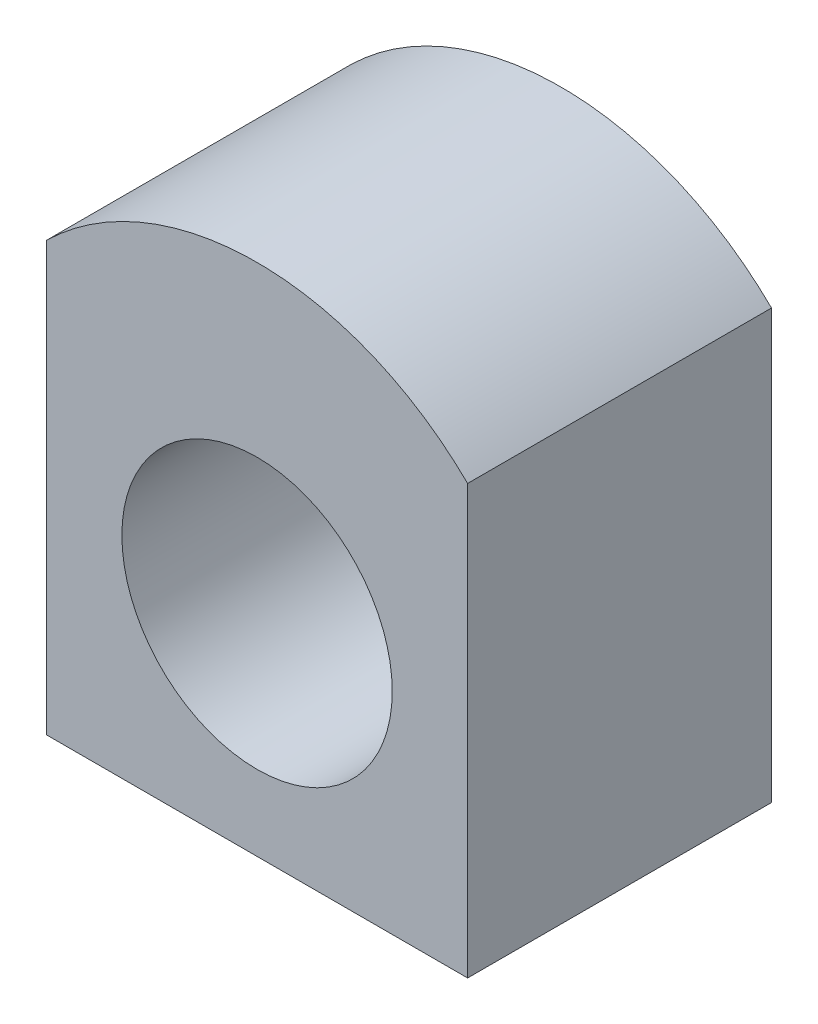
from build123d import *

# Parameters (mm, degrees)
EXTRUDE_1_DEPTH     = 12.7
SKETCH_2_R          = 5.65
CUT_EXTRUDE_1_DEPTH = 27.476026892


with BuildPart() as part:
    # Эскиз1 → Бобышка-Вытянуть1 (new body)
    with BuildSketch(Plane.XY):
        with BuildLine():
            Line((-8.8, 0), (8.8, 0))
            Line((8.8, 0), (8.8, 17.9))
            ThreePointArc((8.8, 17.9), (0, 21.5), (-8.8, 17.9))
            Line((-8.8, 17.9), (-8.8, 0))
        make_face()
    extrude(amount=EXTRUDE_1_DEPTH)

    # Эскиз2 → Вырез-Вытянуть1 (cut, through all)
    with BuildSketch(Plane.XY.offset(12.7)):
        with Locations((0, 8.8)):
            Circle(SKETCH_2_R)
    extrude(amount=-CUT_EXTRUDE_1_DEPTH, mode=Mode.SUBTRACT)


solid = part.part
